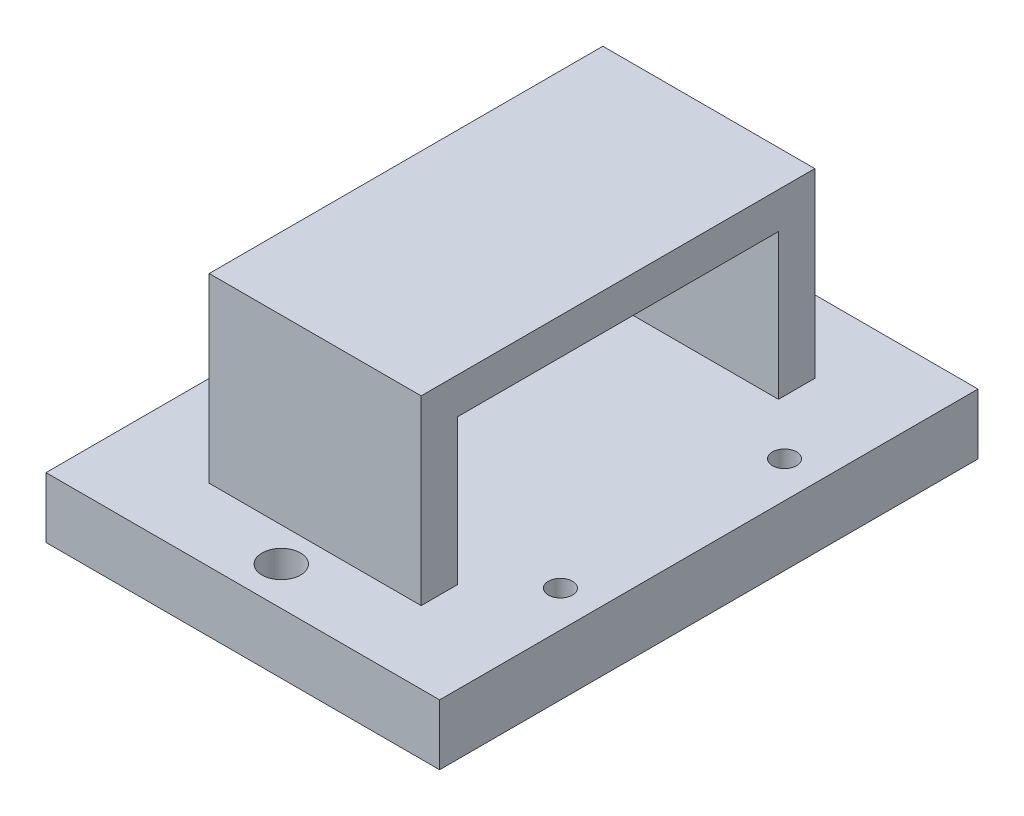
from build123d import *

# Parameters (mm, degrees)
SKETCH2_W           = 65
SKETCH2_H           = 65
BOSS_EXTRUDE1_DEPTH = 10
SKETCH3_W           = 65
SKETCH3_H           = 6
SKETCH3_W_2         = 6
SKETCH3_H_2         = 24
BOSS_EXTRUDE2_DEPTH = 17.5
SKETCH4_R           = 3.175
BOSS_EXTRUDE3_DEPTH = 10
SKETCH5_R           = 1.99
CUT_EXTRUDE1_DEPTH  = 63.706080247


with BuildPart() as part:
    # Sketch2 → Boss-Extrude1 (new body)
    with BuildSketch(Plane(origin=(0, 0, 0), x_dir=(1, 0, 0), z_dir=(0, 1, 0))):
        Rectangle(SKETCH2_W, SKETCH2_H)
    extrude(amount=-BOSS_EXTRUDE1_DEPTH)

    # Sketch3 → Boss-Extrude2 (add, symmetric)
    with BuildSketch(Plane(origin=(0, 0, 0), x_dir=(0, 0, -1), z_dir=(1, 0, 0))):
        with Locations((0, 27)):
            Rectangle(SKETCH3_W, SKETCH3_H)
        with Locations((29.5, 12)):
            Rectangle(SKETCH3_W_2, SKETCH3_H_2)
        with Locations((-29.5, 12)):
            Rectangle(SKETCH3_W_2, SKETCH3_H_2)
    extrude(amount=BOSS_EXTRUDE2_DEPTH, both=True)

    # Sketch4 → Boss-Extrude3 (add)
    # profile 1 of 2: a face of its own
    with BuildSketch(Plane(origin=(0, 0, 0), x_dir=(1, 0, 0), z_dir=(0, 1, 0))):
        Polygon((32.5, 44.45), (-32.5, 44.45), (-32.5, 32.5), (-17.5, 32.5), (-17.5, 26.5), (17.5, 26.5), (17.5, 32.5), (32.5, 32.5), align=None)
        with Locations(Location((0, 38.1, 0), (0, 0, 270))):
            Circle(SKETCH4_R, mode=Mode.SUBTRACT)
    # profile 2 of 2: a face of its own
    with BuildSketch(Plane(origin=(0, 0, 0), x_dir=(1, 0, 0), z_dir=(0, 1, 0))):
        Polygon((-17.5, -32.5), (-32.5, -32.5), (-32.5, -44.45), (32.5, -44.45), (32.5, -32.5), (17.5, -32.5), (17.5, -26.5), (-17.5, -26.5), align=None)
        with Locations(Location((0, -38.1, 0), (0, 0, 270))):
            Circle(SKETCH4_R, mode=Mode.SUBTRACT)
    extrude(amount=-BOSS_EXTRUDE3_DEPTH)

    # Sketch5 → Cut-Extrude1 (cut, through all)
    with BuildSketch(Plane(origin=(0, 0, 0), x_dir=(1, 0, 0), z_dir=(0, 1, 0))):
        with Locations(Location((-26.5, 18.5, 0), (0, 0, 270))):
            Circle(SKETCH5_R)
        with Locations(Location((26.5, 18.5, 0), (0, 0, 270))):
            Circle(SKETCH5_R)
        with Locations(Location((26.5, -18.5, 0), (0, 0, 270))):
            Circle(SKETCH5_R)
        with Locations(Location((-26.5, -18.5, 0), (0, 0, 270))):
            Circle(SKETCH5_R)
    extrude(amount=-CUT_EXTRUDE1_DEPTH, mode=Mode.SUBTRACT)


solid = part.part
